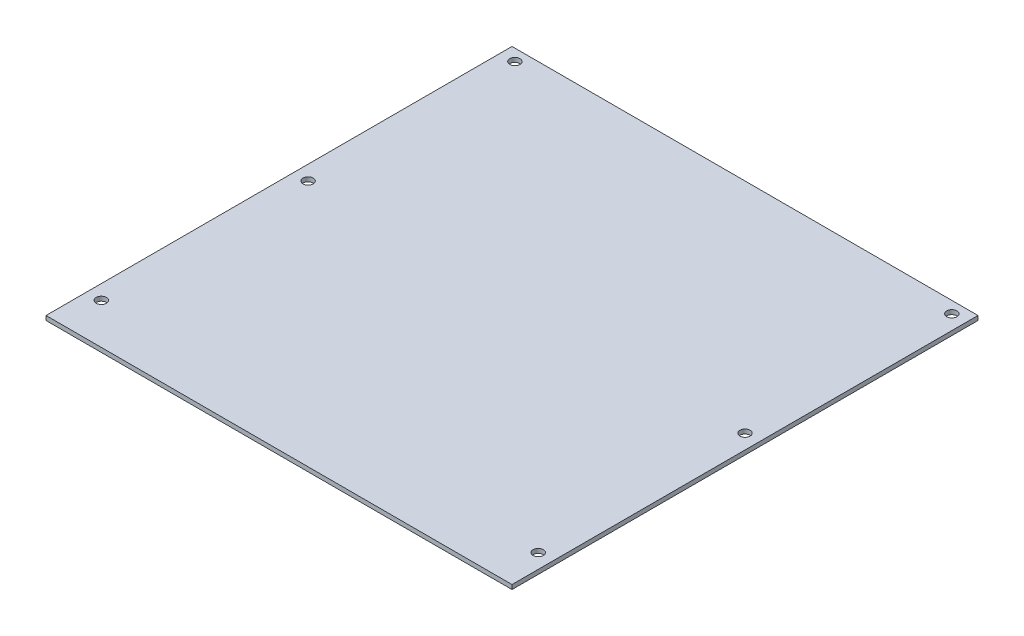
from build123d import *

# Parameters (mm, degrees)
CROQUIS1_W              = 160
CROQUIS1_H              = 160
CROQUIS1_R              = 1.75
SALIENTE_EXTRUIR1_DEPTH = 1.5


with BuildPart() as part:
    # Croquis1 → Saliente-Extruir1 (new body)
    with BuildSketch(Plane(origin=(0, 0, 0), x_dir=(1, 0, 0), z_dir=(0, 1, 0))):
        Rectangle(CROQUIS1_W, CROQUIS1_H)
        with Locations(Location((-75, 76, 0), (0, 0, 270))):
            Circle(CROQUIS1_R, mode=Mode.SUBTRACT)
        with Locations(Location((75, 76, 0), (0, 0, 90))):
            Circle(CROQUIS1_R, mode=Mode.SUBTRACT)
        with Locations(Location((-75, 5, 0), (0, 0, 270))):
            Circle(CROQUIS1_R, mode=Mode.SUBTRACT)
        with Locations(Location((-75, -66, 0), (0, 0, 270))):
            Circle(CROQUIS1_R, mode=Mode.SUBTRACT)
        with Locations(Location((75, -66, 0), (0, 0, 270))):
            Circle(CROQUIS1_R, mode=Mode.SUBTRACT)
        with Locations(Location((75, 5, 0), (0, 0, 270))):
            Circle(CROQUIS1_R, mode=Mode.SUBTRACT)
    extrude(amount=SALIENTE_EXTRUIR1_DEPTH)


solid = part.part
